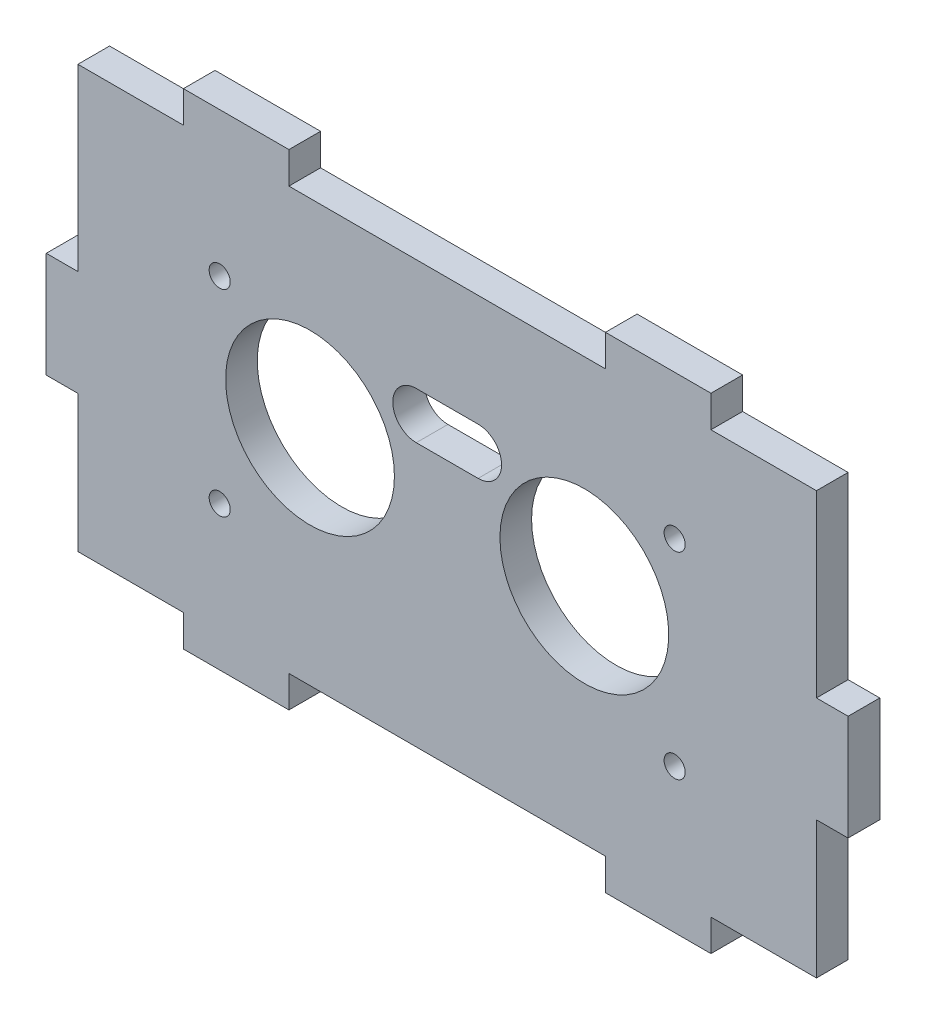
from build123d import *

# Parameters (mm, degrees)
SKETCH_1_R      = 8
SKETCH_1_R_2    = 1
EXTRUDE_1_DEPTH = 3


with BuildPart() as part:
    # 草图1 → 凸台-拉伸1 (new body)
    with BuildSketch(Plane.XY):
        Polygon((-35, -7.01394437), (-35, -20), (-25, -20), (-25, -23), (-15, -23), (-15, -20), (15, -20), (15, -23), (25, -23), (25, -20), (35, -20), (35, -7.01394437), (38, -7.01394437), (38, 2.98605563), (35, 2.98605563), (35, 20), (25, 20), (25, 23), (15, 23), (15, 20), (-15, 20), (-15, 23), (-25, 23), (-25, 20), (-35, 20), (-35, 2.98605563), (-38, 2.98605563), (-38, -7.01394437), align=None)
        with Locations((-13, 1.171567705)):
            Circle(SKETCH_1_R, mode=Mode.SUBTRACT)
        with Locations(Location((13, 1.171567705, 0), (0, 0, 180))):
            Circle(SKETCH_1_R, mode=Mode.SUBTRACT)
        with Locations((-21.56, 9.341567705)):
            Circle(SKETCH_1_R_2, mode=Mode.SUBTRACT)
        with Locations(Location((-21.56, -9.341567705, 0), (0, 0, 180))):
            Circle(SKETCH_1_R_2, mode=Mode.SUBTRACT)
        with Locations((21.56, -9.341567705)):
            Circle(SKETCH_1_R_2, mode=Mode.SUBTRACT)
        with Locations(Location((21.56, 9.341567705, 0), (0, 0, 180))):
            Circle(SKETCH_1_R_2, mode=Mode.SUBTRACT)
        with BuildLine():
            Line((-2.93, 9.425), (2.93, 9.425))
            ThreePointArc((2.93, 9.425), (5.155, 7.2), (2.93, 4.975))
            Line((2.93, 4.975), (-2.93, 4.975))
            ThreePointArc((-2.93, 4.975), (-5.155, 7.2), (-2.93, 9.425))
        make_face(mode=Mode.SUBTRACT)
    extrude(amount=EXTRUDE_1_DEPTH)


solid = part.part
